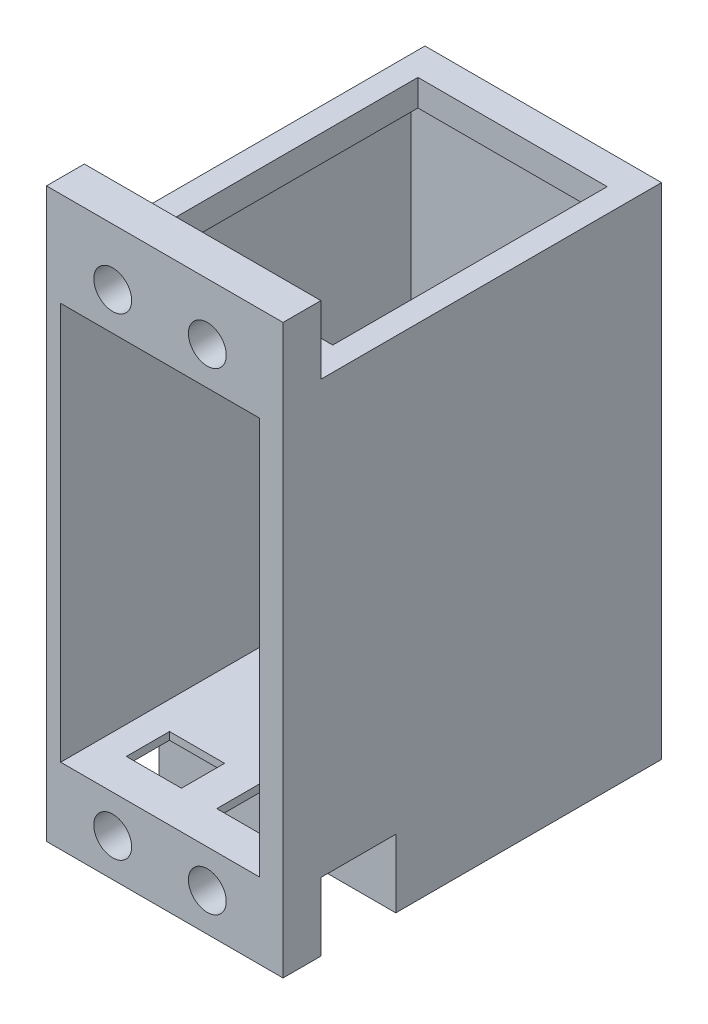
from build123d import *

# Parameters (mm, degrees)
SKETCH2_W           = 25
SKETCH2_H           = 40
BOSS_EXTRUDE3_DEPTH = 60
SKETCH13_W          = 21
SKETCH13_H          = 42
CUT_EXTRUDE5_DEPTH  = 37
SKETCH15_W          = 25
SKETCH15_H          = 7.915590507
CUT_EXTRUDE7_DEPTH  = 7.2
SKETCH16_R          = 1.5
CUT_EXTRUDE8_DEPTH  = 8
SKETCH17_W          = 25
SKETCH17_H          = 36
CUT_EXTRUDE9_DEPTH  = 7.2
SKETCH19_W          = 20
SKETCH19_H          = 29
CUT_EXTRUDE10_DEPTH = 4
SKETCH23_R          = 2
CUT_EXTRUDE12_DEPTH = 10
SKETCH24_W          = 5.82179869
SKETCH24_H          = 4.560057011
SKETCH24_W_2        = 6.048044386
CUT_EXTRUDE14_DEPTH = 1
SKETCH25_W          = 3.2
SKETCH25_H          = 3.755693487
CUT_EXTRUDE15_DEPTH = 1
SKETCH28_R          = 1.5
BOSS_EXTRUDE4_DEPTH = 4
SKETCH29_R          = 1
CUT_EXTRUDE16_DEPTH = 10


with BuildPart() as part:
    # Sketch2 → Boss-Extrude3 (new body)
    with BuildSketch(Plane(origin=(0, 0, 0), x_dir=(1, 0, 0), z_dir=(0, 1, 0))):
        Rectangle(SKETCH2_W, SKETCH2_H)
    extrude(amount=BOSS_EXTRUDE3_DEPTH)

    # Sketch13 → Cut-Extrude5 (cut)
    with BuildSketch(Plane.XY.offset(20)):
        with Locations((-0.5, 29)):
            Rectangle(SKETCH13_W, SKETCH13_H)
    extrude(amount=-CUT_EXTRUDE5_DEPTH, mode=Mode.SUBTRACT)

    # Sketch15 → Cut-Extrude7 (cut)
    with BuildSketch(Plane.XZ):
        with Locations((0, 12.042204747)):
            Rectangle(SKETCH15_W, SKETCH15_H)
    extrude(amount=-CUT_EXTRUDE7_DEPTH, mode=Mode.SUBTRACT)

    # Sketch16 → Cut-Extrude8 (cut)
    with BuildSketch(Plane.XZ):
        with Locations(Location((0, -11.240217596, 0), (0, 0, 270))):
            Circle(SKETCH16_R)
    extrude(amount=-CUT_EXTRUDE8_DEPTH, mode=Mode.SUBTRACT)

    # Sketch17 → Cut-Extrude9 (cut)
    with BuildSketch(Plane(origin=(0, 60, 0), x_dir=(1, 0, 0), z_dir=(0, 1, 0))):
        with Locations((0, 2)):
            Rectangle(SKETCH17_W, SKETCH17_H)
    extrude(amount=-CUT_EXTRUDE9_DEPTH, mode=Mode.SUBTRACT)

    # Sketch19 → Cut-Extrude10 (cut)
    with BuildSketch(Plane(origin=(0, 52.8, 0), x_dir=(1, 0, 0), z_dir=(0, 1, 0))):
        with Locations((0, 2.255693487)):
            Rectangle(SKETCH19_W, SKETCH19_H)
    extrude(amount=-CUT_EXTRUDE10_DEPTH, mode=Mode.SUBTRACT)

    # Sketch23 → Cut-Extrude12 (cut)
    with BuildSketch(Plane.XY.offset(20)):
        with Locations((-5.5, 54)):
            Circle(SKETCH23_R)
        with Locations((4.5, 54)):
            Circle(SKETCH23_R)
        with Locations((-5.5, 4)):
            Circle(SKETCH23_R)
        with Locations((4.5, 4)):
            Circle(SKETCH23_R)
    extrude(amount=-CUT_EXTRUDE12_DEPTH, mode=Mode.SUBTRACT)

    # Sketch24 → Cut-Extrude14 (cut)
    with BuildSketch(Plane.XZ.offset(-7.2)):
        with Locations((-5.147829388, 13.719971495)):
            Rectangle(SKETCH24_W, SKETCH24_H)
        with Locations((4.519232113, 13.719971495)):
            Rectangle(SKETCH24_W_2, SKETCH24_H)
    extrude(amount=-CUT_EXTRUDE14_DEPTH, mode=Mode.SUBTRACT)

    # Sketch25 → Cut-Extrude15 (cut)
    with BuildSketch(Plane(origin=(0, 52.8, 0), x_dir=(1, 0, 0), z_dir=(0, 1, 0))):
        with Locations((-5.5, -14.122153257)):
            Rectangle(SKETCH25_W, SKETCH25_H)
        with Locations((4.5, -14.122153257)):
            Rectangle(SKETCH25_W, SKETCH25_H)
    extrude(amount=-CUT_EXTRUDE15_DEPTH, mode=Mode.SUBTRACT)

    # Sketch28 → Boss-Extrude4 (add)
    with BuildSketch(Plane(origin=(0, 0, -20), x_dir=(-1, 0, 0), z_dir=(0, 0, -1))):
        with Locations(Location((0, 40, 0), (0, 0, 180))):
            Circle(SKETCH28_R)
    extrude(amount=BOSS_EXTRUDE4_DEPTH)

    # Sketch29 → Cut-Extrude16 (cut)
    with BuildSketch(Plane.XZ):
        with Locations(Location((0, -4.240217596, 0), (0, 0, 270))):
            Circle(SKETCH29_R)
        with Locations(Location((-7, -11.240217596, 0), (0, 0, 270))):
            Circle(SKETCH29_R)
        with Locations(Location((7, -11.240217596, 0), (0, 0, 270))):
            Circle(SKETCH29_R)
    extrude(amount=-CUT_EXTRUDE16_DEPTH, mode=Mode.SUBTRACT)


solid = part.part
